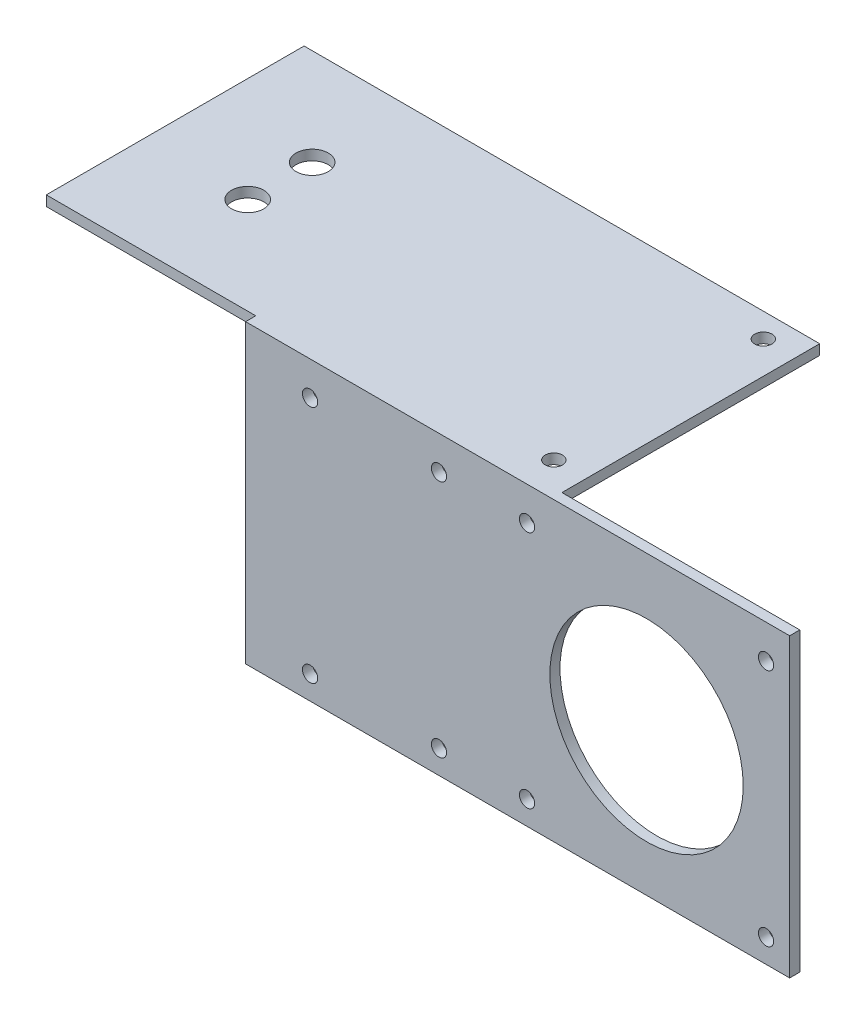
from build123d import *

# Parameters (mm, degrees)
SKETCH1_W           = 107.2
SKETCH1_H           = 58.4
SKETCH1_R           = 1.5
SKETCH1_R_2         = 19.05
BOSS_EXTRUDE1_DEPTH = 2
BOSS_EXTRUDE2_DEPTH = 50.8
SKETCH3_R           = 1.7
SKETCH3_R_2         = 3.175
CUT_EXTRUDE1_DEPTH  = 134.004661572


with BuildPart() as part:
    # Sketch1 → Boss-Extrude1 (new body)
    with BuildSketch(Plane.XY):
        with Locations((53.6, 29.2)):
            Rectangle(SKETCH1_W, SKETCH1_H)
        with Locations((102.55, 51.75)):
            Circle(SKETCH1_R, mode=Mode.SUBTRACT)
        with Locations((102.55, 4.65)):
            Circle(SKETCH1_R, mode=Mode.SUBTRACT)
        with Locations((55.45, 4.65)):
            Circle(SKETCH1_R, mode=Mode.SUBTRACT)
        with Locations((55.45, 51.75)):
            Circle(SKETCH1_R, mode=Mode.SUBTRACT)
        with Locations((12.7, 51.75)):
            Circle(SKETCH1_R, mode=Mode.SUBTRACT)
        with Locations((38.1, 51.75)):
            Circle(SKETCH1_R, mode=Mode.SUBTRACT)
        with Locations((12.7, 4.65)):
            Circle(SKETCH1_R, mode=Mode.SUBTRACT)
        with Locations((38.1, 4.65)):
            Circle(SKETCH1_R, mode=Mode.SUBTRACT)
        with Locations((79, 28.2)):
            Circle(SKETCH1_R_2, mode=Mode.SUBTRACT)
    extrude(amount=-BOSS_EXTRUDE1_DEPTH)

    # Sketch2 → Boss-Extrude2 (add)
    with BuildSketch(Plane(origin=(0, 0, -2), x_dir=(-1, 0, 0), z_dir=(0, 0, -1))):
        Polygon((0, 56.4), (41.275, 56.4), (41.275, 58.4), (0, 58.4), (-60.325, 58.4), (-60.325, 56.4), align=None)
    extrude(amount=BOSS_EXTRUDE2_DEPTH)

    # Sketch3 → Cut-Extrude1 (cut, through all)
    with BuildSketch(Plane(origin=(0, 58.4, 0), x_dir=(1, 0, 0), z_dir=(0, 1, 0))):
        with Locations(Location((53.975, 48.0375, 0), (0, 0, 180))):
            Circle(SKETCH3_R)
        with Locations(Location((53.975, 6.7625, 0), (0, 0, 180))):
            Circle(SKETCH3_R)
        with Locations(Location((-20.6375, 33.75, 0), (0, 0, 180))):
            Circle(SKETCH3_R_2)
        with Locations(Location((-20.6375, 21.05, 0), (0, 0, 180))):
            Circle(SKETCH3_R_2)
    extrude(amount=-CUT_EXTRUDE1_DEPTH, mode=Mode.SUBTRACT)


solid = part.part
